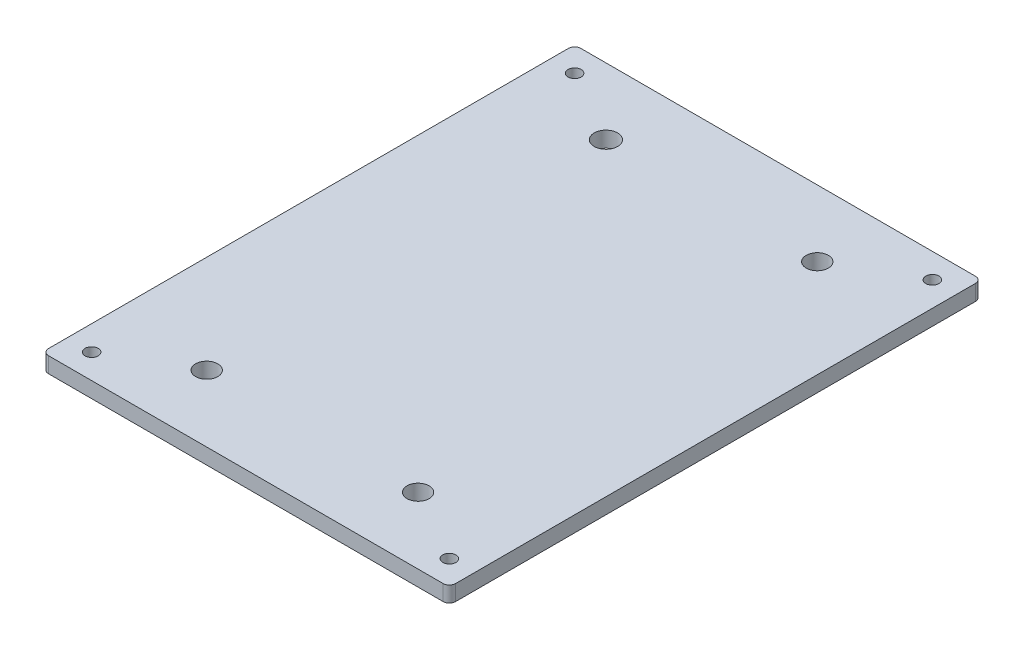
from build123d import *

# Parameters (mm, degrees)
SKETCH1_W           = 165.1
SKETCH1_H           = 215.9
BOSS_EXTRUDE1_DEPTH = 6.35
CUT_EXTRUDE2_REACH  = 138.044
SKETCH3_R           = 2.665
FILLET1_R           = 2.54
CUT_EXTRUDE3_REACH  = 138.044
SKETCH2_R           = 4.7625
SKETCH2_R_2         = 4.5


with BuildPart() as part:
    # Sketch1 → Boss-Extrude1 (new body)
    with BuildSketch(Plane(origin=(0, 0, 0), x_dir=(1, 0, 0), z_dir=(0, 1, 0))):
        Rectangle(SKETCH1_W, SKETCH1_H)
    extrude(amount=BOSS_EXTRUDE1_DEPTH)

    # Sketch3 → Cut-Extrude2 (cut, up to next)
    with BuildSketch(Plane(origin=(0, 6.35, 0), x_dir=(-1, 0, 0), z_dir=(0, 1, 0)), mode=Mode.PRIVATE) as cut_extrude2_sk1:
        with Locations(Location((72.55, 97.95, 0), (0, 0, 90))):
            Circle(SKETCH3_R)
    cut_extrude2_tool1 = extrude(cut_extrude2_sk1.sketch, amount=-CUT_EXTRUDE2_REACH, mode=Mode.PRIVATE) & part.part
    # Sketch3 → Cut-Extrude2 (cut, up to next)
    with BuildSketch(Plane(origin=(0, 6.35, 0), x_dir=(-1, 0, 0), z_dir=(0, 1, 0)), mode=Mode.PRIVATE) as cut_extrude2_sk2:
        with Locations(Location((-72.55, 97.95, 0), (0, 0, 90))):
            Circle(SKETCH3_R)
    cut_extrude2_tool2 = extrude(cut_extrude2_sk2.sketch, amount=-CUT_EXTRUDE2_REACH, mode=Mode.PRIVATE) & part.part
    # Sketch3 → Cut-Extrude2 (cut, up to next)
    with BuildSketch(Plane(origin=(0, 6.35, 0), x_dir=(-1, 0, 0), z_dir=(0, 1, 0)), mode=Mode.PRIVATE) as cut_extrude2_sk3:
        with Locations(Location((-72.55, -97.95, 0), (0, 0, 90))):
            Circle(SKETCH3_R)
    cut_extrude2_tool3 = extrude(cut_extrude2_sk3.sketch, amount=-CUT_EXTRUDE2_REACH, mode=Mode.PRIVATE) & part.part
    # Sketch3 → Cut-Extrude2 (cut, up to next)
    with BuildSketch(Plane(origin=(0, 6.35, 0), x_dir=(-1, 0, 0), z_dir=(0, 1, 0)), mode=Mode.PRIVATE) as cut_extrude2_sk4:
        with Locations(Location((72.55, -97.95, 0), (0, 0, 90))):
            Circle(SKETCH3_R)
    cut_extrude2_tool4 = extrude(cut_extrude2_sk4.sketch, amount=-CUT_EXTRUDE2_REACH, mode=Mode.PRIVATE) & part.part
    add(cut_extrude2_tool1.solids().sort_by_distance((-72.55, 6.35, 97.95))[0], mode=Mode.SUBTRACT)
    add(cut_extrude2_tool2.solids().sort_by_distance((72.55, 6.35, 97.95))[0], mode=Mode.SUBTRACT)
    add(cut_extrude2_tool3.solids().sort_by_distance((72.55, 6.35, -97.95))[0], mode=Mode.SUBTRACT)
    add(cut_extrude2_tool4.solids().sort_by_distance((-72.55, 6.35, -97.95))[0], mode=Mode.SUBTRACT)

    # Fillet1
    fillet1_edges = [part.edges().sort_by_distance(p)[0] for p in [
        (-82.55, 3.175, -107.95),
        (82.55, 3.175, -107.95),
        (82.55, 3.175, 107.95),
        (-82.55, 3.175, 107.95),
    ]]
    fillet(fillet1_edges, radius=FILLET1_R)

    # Sketch2 → Cut-Extrude3 (cut, up to next)
    with BuildSketch(Plane(origin=(0, 6.35, 0), x_dir=(1, 0, 0), z_dir=(0, 1, 0)), mode=Mode.PRIVATE) as cut_extrude3_sk1:
        with Locations(Location((-42.8625, 80.9625, 0), (0, 0, 270))):
            Circle(SKETCH2_R)
    cut_extrude3_tool1 = extrude(cut_extrude3_sk1.sketch, amount=-CUT_EXTRUDE3_REACH, mode=Mode.PRIVATE) & part.part
    # Sketch2 → Cut-Extrude3 (cut, up to next)
    with BuildSketch(Plane(origin=(0, 6.35, 0), x_dir=(1, 0, 0), z_dir=(0, 1, 0)), mode=Mode.PRIVATE) as cut_extrude3_sk2:
        with Locations(Location((-42.8625, -80.9625, 0), (0, 0, 270))):
            Circle(SKETCH2_R_2)
    cut_extrude3_tool2 = extrude(cut_extrude3_sk2.sketch, amount=-CUT_EXTRUDE3_REACH, mode=Mode.PRIVATE) & part.part
    # Sketch2 → Cut-Extrude3 (cut, up to next)
    with BuildSketch(Plane(origin=(0, 6.35, 0), x_dir=(1, 0, 0), z_dir=(0, 1, 0)), mode=Mode.PRIVATE) as cut_extrude3_sk3:
        with Locations(Location((42.8625, -80.9625, 0), (0, 0, 270))):
            Circle(SKETCH2_R_2)
    cut_extrude3_tool3 = extrude(cut_extrude3_sk3.sketch, amount=-CUT_EXTRUDE3_REACH, mode=Mode.PRIVATE) & part.part
    # Sketch2 → Cut-Extrude3 (cut, up to next)
    with BuildSketch(Plane(origin=(0, 6.35, 0), x_dir=(1, 0, 0), z_dir=(0, 1, 0)), mode=Mode.PRIVATE) as cut_extrude3_sk4:
        with Locations(Location((42.8625, 80.9625, 0), (0, 0, 270))):
            Circle(SKETCH2_R_2)
    cut_extrude3_tool4 = extrude(cut_extrude3_sk4.sketch, amount=-CUT_EXTRUDE3_REACH, mode=Mode.PRIVATE) & part.part
    add(cut_extrude3_tool1.solids().sort_by_distance((-42.8625, 6.35, -80.9625))[0], mode=Mode.SUBTRACT)
    add(cut_extrude3_tool2.solids().sort_by_distance((-42.8625, 6.35, 80.9625))[0], mode=Mode.SUBTRACT)
    add(cut_extrude3_tool3.solids().sort_by_distance((42.8625, 6.35, 80.9625))[0], mode=Mode.SUBTRACT)
    add(cut_extrude3_tool4.solids().sort_by_distance((42.8625, 6.35, -80.9625))[0], mode=Mode.SUBTRACT)


solid = part.part
